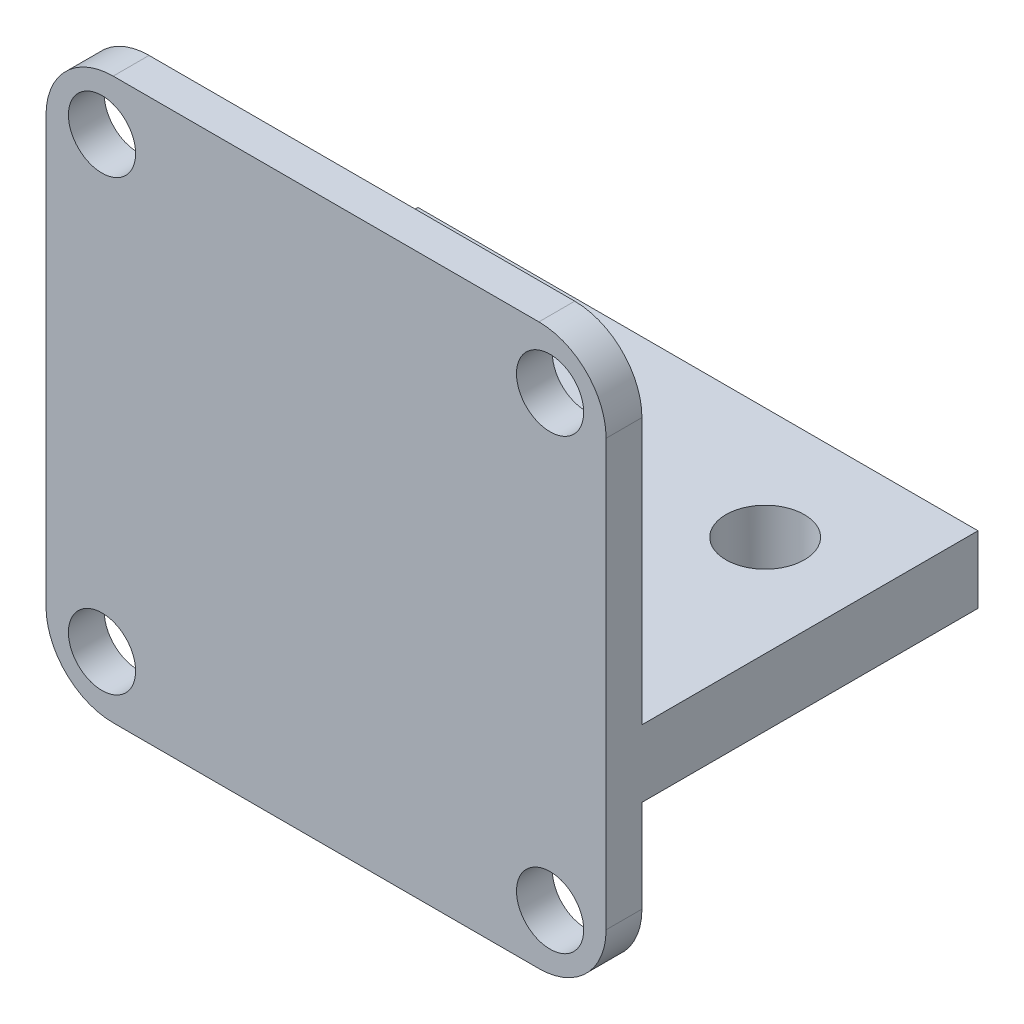
from build123d import *

# Parameters (mm, degrees)
SKETCH1_R           = 1.5
BOSS_EXTRUDE1_DEPTH = 1.6
SKETCH2_W           = 25
SKETCH2_H           = 3
BOSS_EXTRUDE2_DEPTH = 15
SKETCH3_R           = 1.75
CUT_EXTRUDE1_DEPTH  = 25.546193697


with BuildPart() as part:
    # Sketch1 → Boss-Extrude1 (new body)
    with BuildSketch(Plane.XY):
        with BuildLine():
            Line((-9.5, -12.5), (9.5, -12.5))
            ThreePointArc((9.5, -12.5), (11.621320344, -11.621320344), (12.5, -9.5))
            Line((12.5, -9.5), (12.5, 9.5))
            ThreePointArc((12.5, 9.5), (11.621320344, 11.621320344), (9.5, 12.5))
            Line((9.5, 12.5), (-9.5, 12.5))
            ThreePointArc((-9.5, 12.5), (-11.621320344, 11.621320344), (-12.5, 9.5))
            Line((-12.5, 9.5), (-12.5, -9.5))
            ThreePointArc((-12.5, -9.5), (-11.621320344, -11.621320344), (-9.5, -12.5))
        make_face()
        with Locations((-10, 10)):
            Circle(SKETCH1_R, mode=Mode.SUBTRACT)
        with Locations(Location((10, 10, 0), (0, 0, 180))):
            Circle(SKETCH1_R, mode=Mode.SUBTRACT)
        with Locations((10, -10)):
            Circle(SKETCH1_R, mode=Mode.SUBTRACT)
        with Locations(Location((-10, -10, 0), (0, 0, 180))):
            Circle(SKETCH1_R, mode=Mode.SUBTRACT)
    extrude(amount=BOSS_EXTRUDE1_DEPTH)

    # Sketch2 → Boss-Extrude2 (add)
    with BuildSketch(Plane(origin=(0, 0, 0), x_dir=(-1, 0, 0), z_dir=(0, 0, -1))):
        with Locations((0, -3.875)):
            Rectangle(SKETCH2_W, SKETCH2_H)
    extrude(amount=BOSS_EXTRUDE2_DEPTH)

    # Sketch3 → Cut-Extrude1 (cut, through all)
    with BuildSketch(Plane(origin=(0, -2.375, 0), x_dir=(1, 0, 0), z_dir=(0, 1, 0))):
        with Locations(Location((-8, 10, 0), (0, 0, 270))):
            Circle(SKETCH3_R)
        with Locations(Location((8, 10, 0), (0, 0, 270))):
            Circle(SKETCH3_R)
    extrude(amount=-CUT_EXTRUDE1_DEPTH, mode=Mode.SUBTRACT)


solid = part.part
